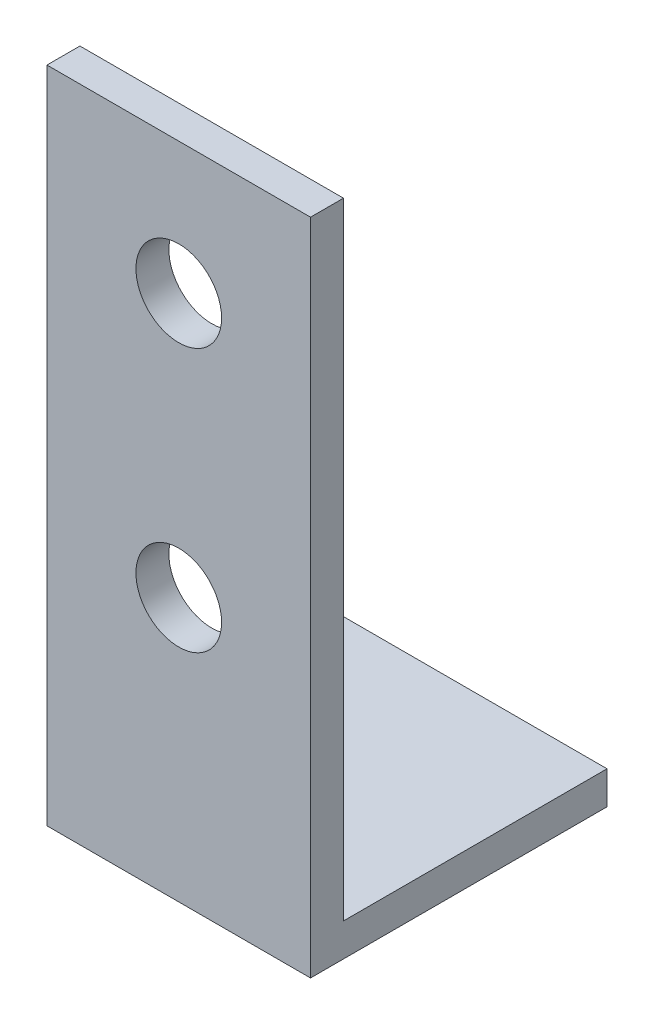
from build123d import *

# Parameters (mm, degrees)
EXTRUDE_1_DEPTH     = 8
SKETCH_2_R          = 1.3
CUT_EXTRUDE_1_DEPTH = 24.34523506


with BuildPart() as part:
    # 草圖1 → 填料-伸長1 (new body)
    with BuildSketch(Plane(origin=(0, 0, 0), x_dir=(0, 0, -1), z_dir=(1, 0, 0))):
        Polygon((0, 0), (9, 0), (9, 1), (1, 1), (1, 20), (0, 20), align=None)
    extrude(amount=EXTRUDE_1_DEPTH)

    # 草圖2 → 除料-伸長1 (cut, through all)
    with BuildSketch(Plane.XY):
        with Locations((4, 16)):
            Circle(SKETCH_2_R)
        with Locations((4, 8)):
            Circle(SKETCH_2_R)
    extrude(amount=-CUT_EXTRUDE_1_DEPTH, mode=Mode.SUBTRACT)


solid = part.part
